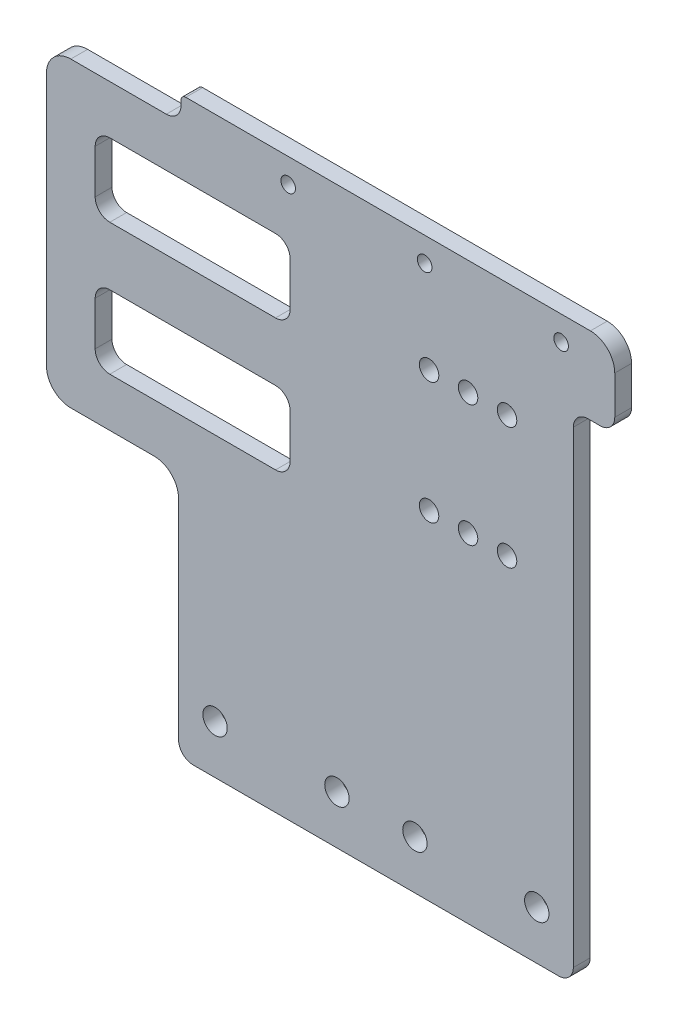
from build123d import *

# Parameters (mm, degrees)
MODEL_R         = 2.5
MODEL_R_2       = 2
MODEL_R_3       = 1.5
EXTRUDE_1_DEPTH = 3.45


with BuildPart() as part:
    # Model → 凸台-拉伸1 (new body)
    with BuildSketch(Plane.XY):
        with BuildLine():
            Line((123.577210347, 109.56127227), (123.577210347, 117.42565066))
            ThreePointArc((123.577210347, 117.42565066), (122.112744253, 120.961184566), (118.577210347, 122.42565066))
            Line((118.577210347, 122.42565066), (35.577210347, 122.42565066))
            ThreePointArc((35.577210347, 122.42565066), (34.870103566, 122.132757441), (34.577210347, 121.42565066))
            Line((34.577210347, 121.42565066), (34.577210347, 120.42565066))
            ThreePointArc((34.577210347, 120.42565066), (33.69853069, 118.304330316), (31.577210347, 117.42565066))
            Line((31.577210347, 117.42565066), (11.977210347, 117.42565066))
            ThreePointArc((11.977210347, 117.42565066), (8.441676441, 115.961184566), (6.977210347, 112.42565066))
            Line((6.977210347, 112.42565066), (6.977210347, 60.42565066))
            ThreePointArc((6.977210347, 60.42565066), (8.441676441, 56.890116754), (11.977210347, 55.42565066))
            Line((11.977210347, 55.42565066), (29.077210347, 55.42565066))
            ThreePointArc((29.077210347, 55.42565066), (32.612744253, 53.961184566), (34.077210347, 50.42565066))
            Line((34.077210347, 50.42565066), (34.077210347, 7.54555066))
            ThreePointArc((34.077210347, 7.54555066), (34.955890003, 5.424230316), (37.077210347, 4.54555066))
            Line((37.077210347, 4.54555066), (112.077210347, 4.54555066))
            ThreePointArc((112.077210347, 4.54555066), (114.19853069, 5.424230316), (115.077210347, 7.54555066))
            Line((115.077210347, 7.54555066), (115.077210347, 103.56127227))
            ThreePointArc((115.077210347, 103.56127227), (115.955890003, 105.682592613), (118.077210347, 106.56127227))
            Line((118.077210347, 106.56127227), (120.577210347, 106.56127227))
            ThreePointArc((120.577210347, 106.56127227), (122.69853069, 107.439951926), (123.577210347, 109.56127227))
        make_face()
        with Locations(Location((82.577210347, 14.54555066, 0), (0, 0, 180))):
            Circle(MODEL_R, mode=Mode.SUBTRACT)
        with Locations(Location((107.577210347, 14.54555066, 0), (0, 0, 180))):
            Circle(MODEL_R, mode=Mode.SUBTRACT)
        with Locations(Location((101.477210347, 98.92565066, 0), (0, 0, 180))):
            Circle(MODEL_R_2, mode=Mode.SUBTRACT)
        with Locations(Location((93.477210347, 98.92565066, 0), (0, 0, 180))):
            Circle(MODEL_R_2, mode=Mode.SUBTRACT)
        with Locations(Location((85.477210347, 98.92565066, 0), (0, 0, 180))):
            Circle(MODEL_R_2, mode=Mode.SUBTRACT)
        with Locations(Location((93.477210347, 73.92565066, 0), (0, 0, 180))):
            Circle(MODEL_R_2, mode=Mode.SUBTRACT)
        with Locations(Location((101.477210347, 73.92565066, 0), (0, 0, 180))):
            Circle(MODEL_R_2, mode=Mode.SUBTRACT)
        with Locations(Location((85.477210347, 73.92565066, 0), (0, 0, 180))):
            Circle(MODEL_R_2, mode=Mode.SUBTRACT)
        with Locations(Location((84.577210347, 117.42565066, 0), (0, 0, 180))):
            Circle(MODEL_R_3, mode=Mode.SUBTRACT)
        with Locations(Location((112.577210347, 117.42565066, 0), (0, 0, 180))):
            Circle(MODEL_R_3, mode=Mode.SUBTRACT)
        with Locations(Location((56.577210347, 117.42565066, 0), (0, 0, 180))):
            Circle(MODEL_R_3, mode=Mode.SUBTRACT)
        with Locations(Location((41.577210347, 14.54555066, 0), (0, 0, 180))):
            Circle(MODEL_R, mode=Mode.SUBTRACT)
        with Locations(Location((66.577210347, 14.54555066, 0), (0, 0, 180))):
            Circle(MODEL_R, mode=Mode.SUBTRACT)
        with BuildLine():
            Line((53.977210347, 65.42565066), (19.977210347, 65.42565066))
            ThreePointArc((19.977210347, 65.42565066), (17.855890003, 66.304330316), (16.977210347, 68.42565066))
            Line((16.977210347, 68.42565066), (16.977210347, 77.42565066))
            ThreePointArc((16.977210347, 77.42565066), (17.855890003, 79.546971003), (19.977210347, 80.42565066))
            Line((19.977210347, 80.42565066), (53.977210347, 80.42565066))
            ThreePointArc((53.977210347, 80.42565066), (56.09853069, 79.546971003), (56.977210347, 77.42565066))
            Line((56.977210347, 77.42565066), (56.977210347, 68.42565066))
            ThreePointArc((56.977210347, 68.42565066), (56.09853069, 66.304330316), (53.977210347, 65.42565066))
        make_face(mode=Mode.SUBTRACT)
        with BuildLine():
            Line((53.977210347, 107.42565066), (19.977210347, 107.42565066))
            ThreePointArc((19.977210347, 107.42565066), (17.855890003, 106.546971003), (16.977210347, 104.42565066))
            Line((16.977210347, 104.42565066), (16.977210347, 95.42565066))
            ThreePointArc((16.977210347, 95.42565066), (17.855890003, 93.304330316), (19.977210347, 92.42565066))
            Line((19.977210347, 92.42565066), (53.977210347, 92.42565066))
            ThreePointArc((53.977210347, 92.42565066), (56.09853069, 93.304330316), (56.977210347, 95.42565066))
            Line((56.977210347, 95.42565066), (56.977210347, 104.42565066))
            ThreePointArc((56.977210347, 104.42565066), (56.09853069, 106.546971003), (53.977210347, 107.42565066))
        make_face(mode=Mode.SUBTRACT)
    extrude(amount=EXTRUDE_1_DEPTH)


solid = part.part
